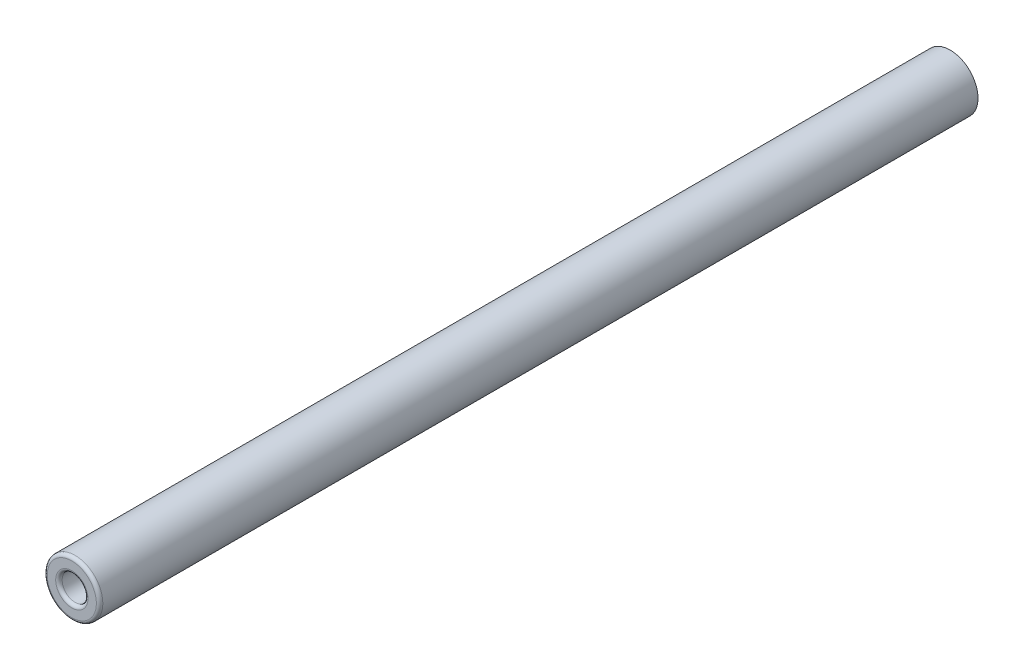
from build123d import *

# Parameters (mm, degrees)
SKETCH1_R           = 2.15
BOSS_EXTRUDE1_DEPTH = 68
SKETCH2_R           = 1
CUT_EXTRUDE1_DEPTH  = 10
FILLET1_R           = 0.25
SCALE1_SCALE        = 5


with BuildPart() as part:
    # Sketch1 → Boss-Extrude1 (new body)
    with BuildSketch(Plane.XY):
        Circle(SKETCH1_R)
    extrude(amount=BOSS_EXTRUDE1_DEPTH)

    # Sketch2 → Cut-Extrude1 (cut)
    with BuildSketch(Plane.XY.offset(68)):
        Circle(SKETCH2_R)
    extrude(amount=-CUT_EXTRUDE1_DEPTH, mode=Mode.SUBTRACT)

    # Fillet1
    fillet1_edges = [part.edges().sort_by_distance(p)[0] for p in [
        (-2.15, 0, 68),
        (-1, 0, 68),
    ]]
    fillet(fillet1_edges, radius=FILLET1_R)


with BuildPart() as part_1:
    # Scale1: scaled about (0, 0, 0)
    add(part.part.scale(SCALE1_SCALE))


solid = part_1.part
